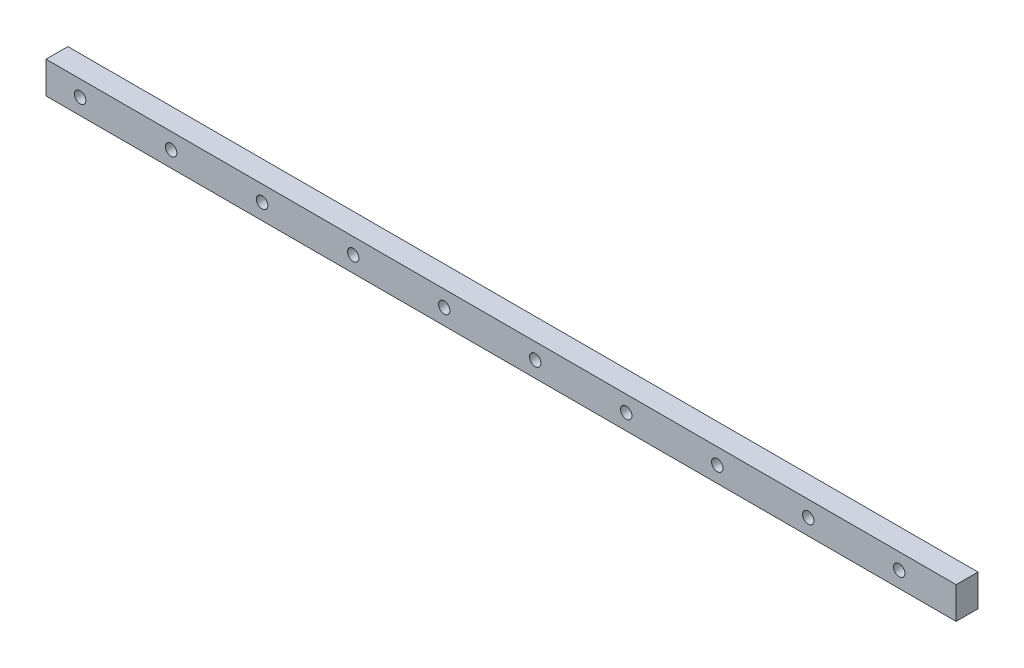
from build123d import *

# Parameters (mm, degrees)
SKETCH_1_W      = 200
SKETCH_1_H      = 7
SKETCH_1_R      = 1.25
EXTRUDE_1_DEPTH = 4.8


with BuildPart() as part:
    # 草图1 → 凸台-拉伸1 (new body)
    with BuildSketch(Plane.XY):
        with Locations((100, -3.5)):
            Rectangle(SKETCH_1_W, SKETCH_1_H)
        with Locations((7.5, -3.5)):
            Circle(SKETCH_1_R, mode=Mode.SUBTRACT)
        with Locations((27.5, -3.5)):
            Circle(SKETCH_1_R, mode=Mode.SUBTRACT)
        with Locations((47.5, -3.5)):
            Circle(SKETCH_1_R, mode=Mode.SUBTRACT)
        with Locations((67.5, -3.5)):
            Circle(SKETCH_1_R, mode=Mode.SUBTRACT)
        with Locations((87.5, -3.5)):
            Circle(SKETCH_1_R, mode=Mode.SUBTRACT)
        with Locations((107.5, -3.5)):
            Circle(SKETCH_1_R, mode=Mode.SUBTRACT)
        with Locations((127.5, -3.5)):
            Circle(SKETCH_1_R, mode=Mode.SUBTRACT)
        with Locations((147.5, -3.5)):
            Circle(SKETCH_1_R, mode=Mode.SUBTRACT)
        with Locations((167.5, -3.5)):
            Circle(SKETCH_1_R, mode=Mode.SUBTRACT)
        with Locations((187.5, -3.5)):
            Circle(SKETCH_1_R, mode=Mode.SUBTRACT)
    extrude(amount=EXTRUDE_1_DEPTH)


solid = part.part
